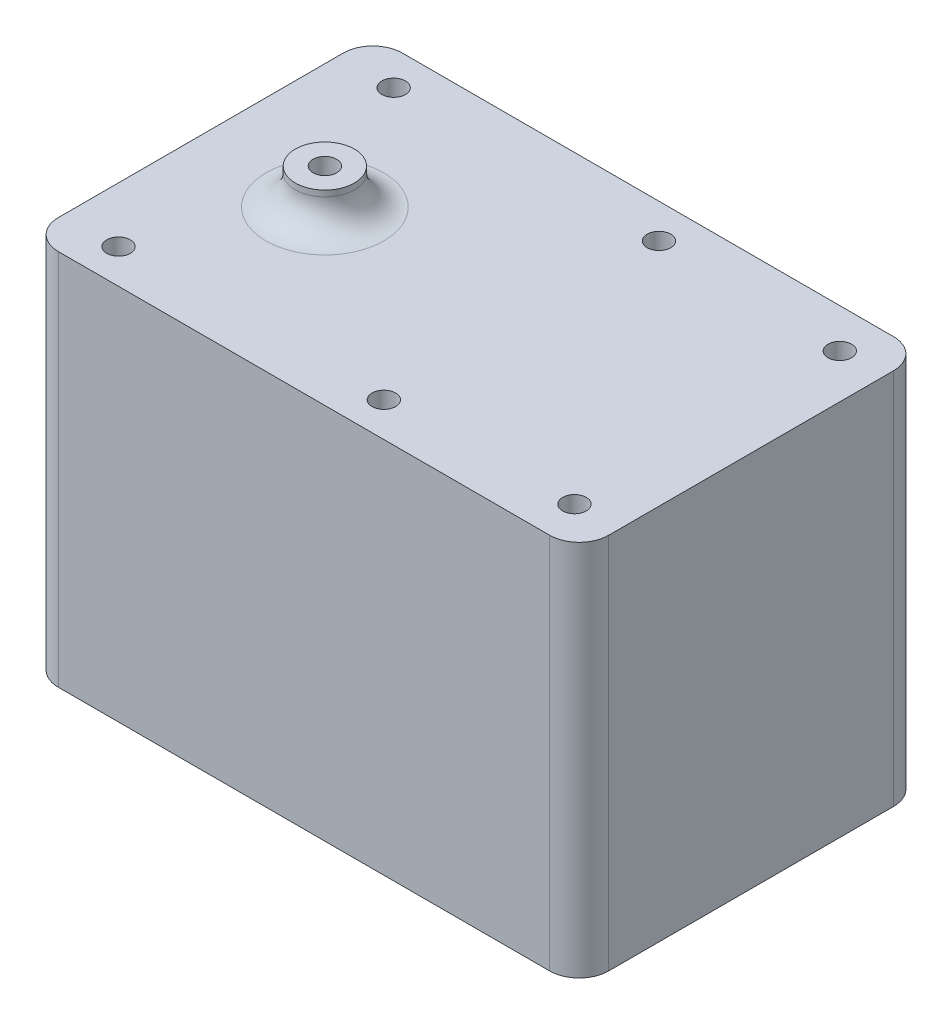
from build123d import *

# Parameters (mm, degrees)
SKETCH1_W           = 56
SKETCH1_H           = 35
SKETCH1_R           = 1.2
BOSS_EXTRUDE1_DEPTH = 38.4
SKETCH2_R           = 3
SKETCH2_R_2         = 1.2
BOSS_EXTRUDE2_DEPTH = 3.6
FILLET2_R           = 3


with BuildPart() as part:
    # Sketch1 → Boss-Extrude1 (new body)
    with BuildSketch(Plane(origin=(0, 0, 0), x_dir=(1, 0, 0), z_dir=(0, 1, 0))):
        Rectangle(SKETCH1_W, SKETCH1_H)
        with Locations(Location((-22.38, 14, 0), (0, 0, 270))):
            Circle(SKETCH1_R, mode=Mode.SUBTRACT)
        with Locations(Location((4.62, 14, 0), (0, 0, 270))):
            Circle(SKETCH1_R, mode=Mode.SUBTRACT)
        with Locations(Location((-22.38, -14, 0), (0, 0, 270))):
            Circle(SKETCH1_R, mode=Mode.SUBTRACT)
        with Locations(Location((4.62, -14, 0), (0, 0, 270))):
            Circle(SKETCH1_R, mode=Mode.SUBTRACT)
        with Locations(Location((23.52, 13.5, 0), (0, 0, 270))):
            Circle(SKETCH1_R, mode=Mode.SUBTRACT)
        with Locations(Location((23.52, -13.5, 0), (0, 0, 270))):
            Circle(SKETCH1_R, mode=Mode.SUBTRACT)
    extrude(amount=BOSS_EXTRUDE1_DEPTH)

    # Sketch2 → Boss-Extrude2 (add)
    with BuildSketch(Plane.XZ):
        with Locations(Location((-15.38, 0, 0), (0, 0, 90))):
            Circle(SKETCH2_R)
        with Locations(Location((-15.38, 0, 0), (0, 0, 270))):
            Circle(SKETCH2_R_2, mode=Mode.SUBTRACT)
    boss_extrude2 = extrude(amount=BOSS_EXTRUDE2_DEPTH)

    # Mirror2: Boss-Extrude2 across plane
    add(boss_extrude2.mirror(Plane(origin=(0, 19.2, 0), x_dir=(0, 0, 1), z_dir=(0, -1, 0))))

    # Fillet2
    fillet2_edges = [part.edges().sort_by_distance(p)[0] for p in [
        (-15.38, 0, -3),
        (-15.38, 38.4, -3),
        (-28, 19.2, -17.5),
        (28, 19.2, -17.5),
        (28, 19.2, 17.5),
        (-28, 19.2, 17.5),
    ]]
    fillet(fillet2_edges, radius=FILLET2_R)


solid = part.part
